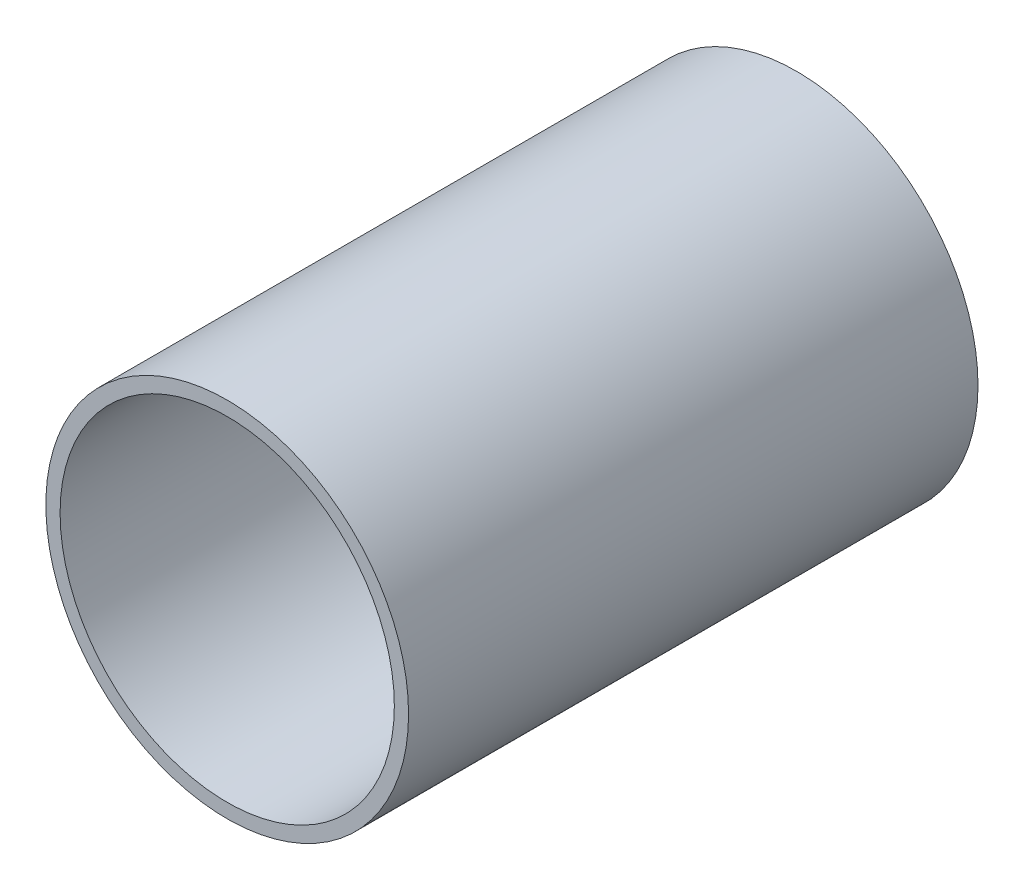
from build123d import *

# Parameters (mm, degrees)
SKETCH1_R           = 3.185
SKETCH1_R_2         = 2.935
BOSS_EXTRUDE2_DEPTH = 10
SKETCH1_6_R         = 2.935
BOSS_EXTRUDE3_DEPTH = 0.5


with BuildPart() as part:
    # Sketch1 → Boss-Extrude2 (new body)
    with BuildSketch(Plane.XY):
        Circle(SKETCH1_R)
        Circle(SKETCH1_R_2, mode=Mode.SUBTRACT)
    extrude(amount=BOSS_EXTRUDE2_DEPTH)

    # Sketch1<6> → Boss-Extrude3 (add)
    with BuildSketch(Plane.XY):
        Circle(SKETCH1_6_R)
    extrude(amount=BOSS_EXTRUDE3_DEPTH)


solid = part.part
